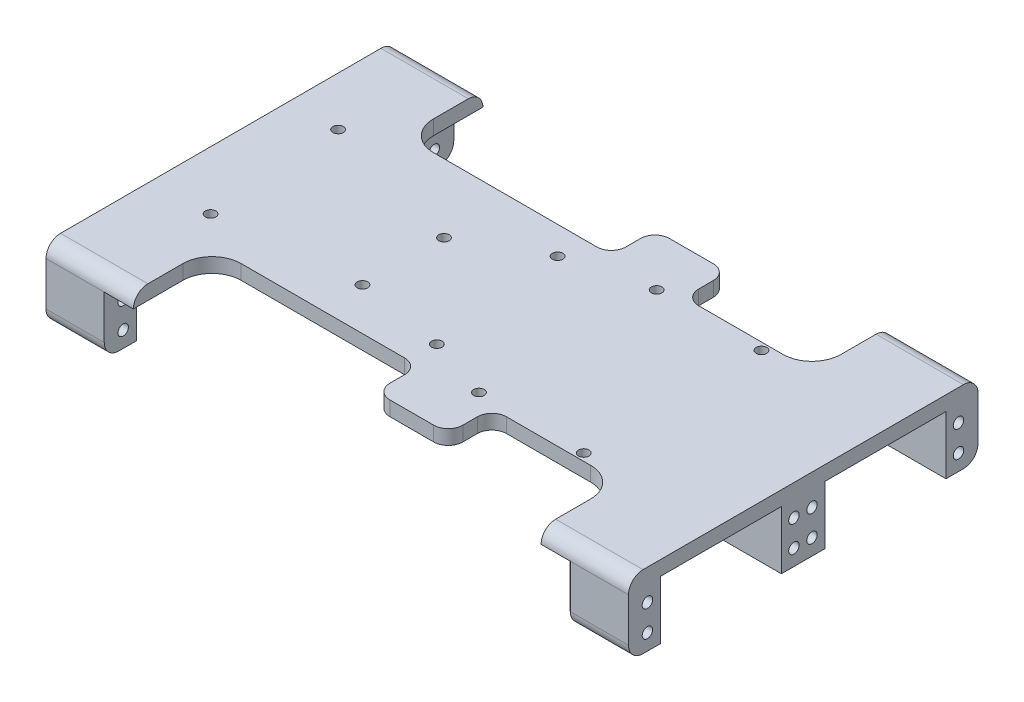
from build123d import *

# Parameters (mm, degrees)
EXTRUDE_1_DEPTH    = 5
SKETCH_3_W         = 20
SKETCH_3_H         = 11
SKETCH_3_H_2       = 7.5
SKETCH_3_H_3       = 15
EXTRUDE_2_DEPTH    = 20
FILLET_1_R         = 5
FILLET_2_R         = 5
HOLE_WIZARD_M3_1_D = 3.6
FILLET_3_R         = 10
HOLE_WIZARD_M3_2_D = 3.6
HOLE_WIZARD_M3_3_D = 3.6
SKETCH_15_W        = 25
SKETCH_15_H        = 15
EXTRUDE_5_DEPTH    = 5
FILLET_8_R         = 5


with BuildPart() as part:
    # 스케치1 → 보스-돌출1 (new body)
    with BuildSketch(Plane(origin=(0, 0, 0), x_dir=(1, 0, 0), z_dir=(0, 1, 0))):
        Polygon((-100, 60), (-70, 60), (-70, 33), (70, 33), (70, 60), (100, 60), (100, -60), (70, -60), (70, -33), (-70, -33), (-70, -60), (-100, -60), align=None)
    extrude(amount=EXTRUDE_1_DEPTH)

    # 스케치3 → 보스-돌출2 (add)
    with BuildSketch(Plane.XZ):
        with Locations((-90, 54.5)):
            Rectangle(SKETCH_3_W, SKETCH_3_H)
        with Locations((-90, 3.75)):
            Rectangle(SKETCH_3_W, SKETCH_3_H_2)
        with Locations((-90, -3.75)):
            Rectangle(SKETCH_3_W, SKETCH_3_H_2)
        with Locations((-90, -54.5)):
            Rectangle(SKETCH_3_W, SKETCH_3_H)
        with Locations((90, 54.5)):
            Rectangle(SKETCH_3_W, SKETCH_3_H)
        with Locations((90, 0)):
            Rectangle(SKETCH_3_W, SKETCH_3_H_3)
        with Locations((90, -54.5)):
            Rectangle(SKETCH_3_W, SKETCH_3_H)
    extrude(amount=EXTRUDE_2_DEPTH)

    # 필렛1
    fillet_1_edges = [part.edges().sort_by_distance(p)[0] for p in [
        (-90, -20, 60),
        (-90, -20, -60),
        (90, -20, 60),
        (90, -20, -60),
    ]]
    fillet(fillet_1_edges, radius=FILLET_1_R)

    # 필렛2
    fillet_2_edges = [part.edges().sort_by_distance(p)[0] for p in [
        (-85, 5, -60),
        (85, 5, -60),
        (85, 5, 60),
        (-85, 5, 60),
    ]]
    fillet(fillet_2_edges, radius=FILLET_2_R)

    # M3 여유 구멍1 (through all)
    with Locations(Plane.ZY.offset(100)):
        with Locations((-3, -5.5), (-3, -14.5), (3.2, -14.5), (3.2, -5.5), (-53.3, -5.5), (-53.3, -14.5), (53.5, -5.5), (53.5, -14.5)):
            Hole(HOLE_WIZARD_M3_1_D / 2)

    # 필렛3
    fillet_3_edges = [part.edges().sort_by_distance(p)[0] for p in [
        (70, 2.5, 33),
        (-70, 2.5, 33),
        (-70, 2.5, -33),
        (70, 2.5, -33),
    ]]
    fillet(fillet_3_edges, radius=FILLET_3_R)

    # M3 여유 구멍2 (through all)
    with Locations(Plane(origin=(0, 5, 0), x_dir=(1, 0, 0), z_dir=(0, 1, 0))):
        with Locations((55.16, 30.5), (19.16, 30.5), (19.16, -30.5), (55.16, -30.5), (57.992156997, -54.362225267)):
            Hole(HOLE_WIZARD_M3_2_D / 2)

    # M3 여유 구멍3 (through all)
    with Locations(Plane(origin=(0, 5, 0), x_dir=(1, 0, 0), z_dir=(0, 1, 0))):
        with Locations((-32.84982536, 9.5), (-2.42900992, -23.37141197), (-7.84982536, 23.5), (-32.84982536, -18.5), (-80, -23.5), (-83.2, 23.5)):
            Hole(HOLE_WIZARD_M3_3_D / 2)

    # 스케치15 → 보스-돌출5 (add)
    with BuildSketch(Plane(origin=(0, 5, 0), x_dir=(1, 0, 0), z_dir=(0, 1, 0))):
        with Locations((13.607404661, -40.5)):
            Rectangle(SKETCH_15_W, SKETCH_15_H)
        with Locations((13.607404661, 40.5)):
            Rectangle(SKETCH_15_W, SKETCH_15_H)
    extrude(amount=-EXTRUDE_5_DEPTH)

    # 필렛8
    fillet_8_edges = [part.edges().sort_by_distance(p)[0] for p in [
        (1.107404661, 2.5, 48),
        (1.107404661, 2.5, 33),
        (26.107404661, 2.5, 33),
        (26.107404661, 2.5, 48),
        (1.107404661, 2.5, -33),
        (1.107404661, 2.5, -48),
        (26.107404661, 2.5, -48),
        (26.107404661, 2.5, -33),
    ]]
    fillet(fillet_8_edges, radius=FILLET_8_R)


solid = part.part
